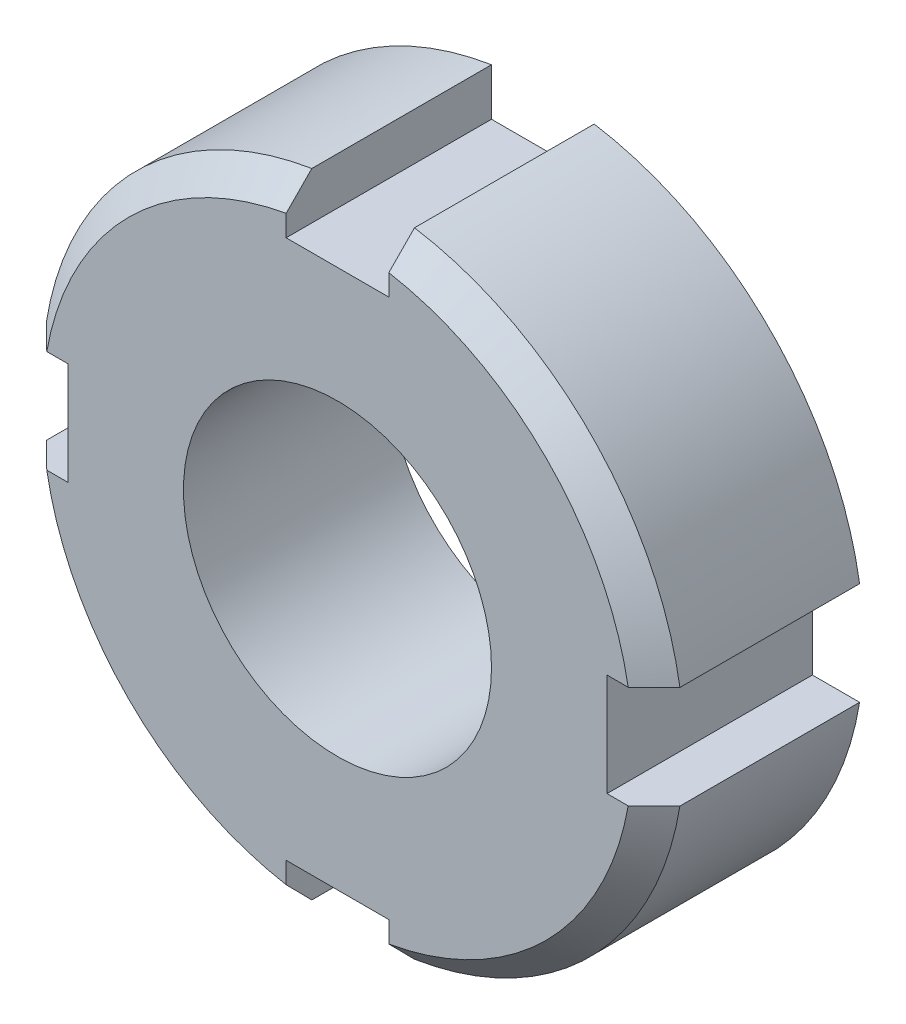
from build123d import *

# Parameters (mm, degrees)
SKETCH1_R           = 12.5
BOSS_EXTRUDE1_DEPTH = 8
SKETCH2_R           = 6
CUT_EXTRUDE1_DEPTH  = 20.403607912
SKETCH3_W           = 4
SKETCH3_H           = 4
CUT_EXTRUDE2_DEPTH  = 20.403607912
CHAMFER1_SIZE       = 1


with BuildPart() as part:
    # Sketch1 → Boss-Extrude1 (new body)
    with BuildSketch(Plane.XY):
        Circle(SKETCH1_R)
    extrude(amount=BOSS_EXTRUDE1_DEPTH)

    # Sketch2 → Cut-Extrude1 (cut, through all)
    with BuildSketch(Plane.XY.offset(8)):
        Circle(SKETCH2_R)
    extrude(amount=-CUT_EXTRUDE1_DEPTH, mode=Mode.SUBTRACT)

    # Sketch3 → Cut-Extrude2 (cut, through all)
    with BuildSketch(Plane.XY.offset(8)):
        with Locations((12.5, 0)):
            Rectangle(SKETCH3_W, SKETCH3_H)
        with Locations((0, 12.5)):
            Rectangle(SKETCH3_W, SKETCH3_H)
        with Locations((0, -12.5)):
            Rectangle(SKETCH3_W, SKETCH3_H)
        with Locations((-12.5, 0)):
            Rectangle(SKETCH3_W, SKETCH3_H)
    extrude(amount=-CUT_EXTRUDE2_DEPTH, mode=Mode.SUBTRACT)

    # Chamfer1
    chamfer1_edges = [part.edges().sort_by_distance(p)[0] for p in [
        (-8.838834765, 8.838834765, 8),
        (8.838834765, 8.838834765, 8),
        (8.838834765, -8.838834765, 8),
        (-8.838834765, -8.838834765, 8),
    ]]
    chamfer(chamfer1_edges, length=CHAMFER1_SIZE)


solid = part.part
